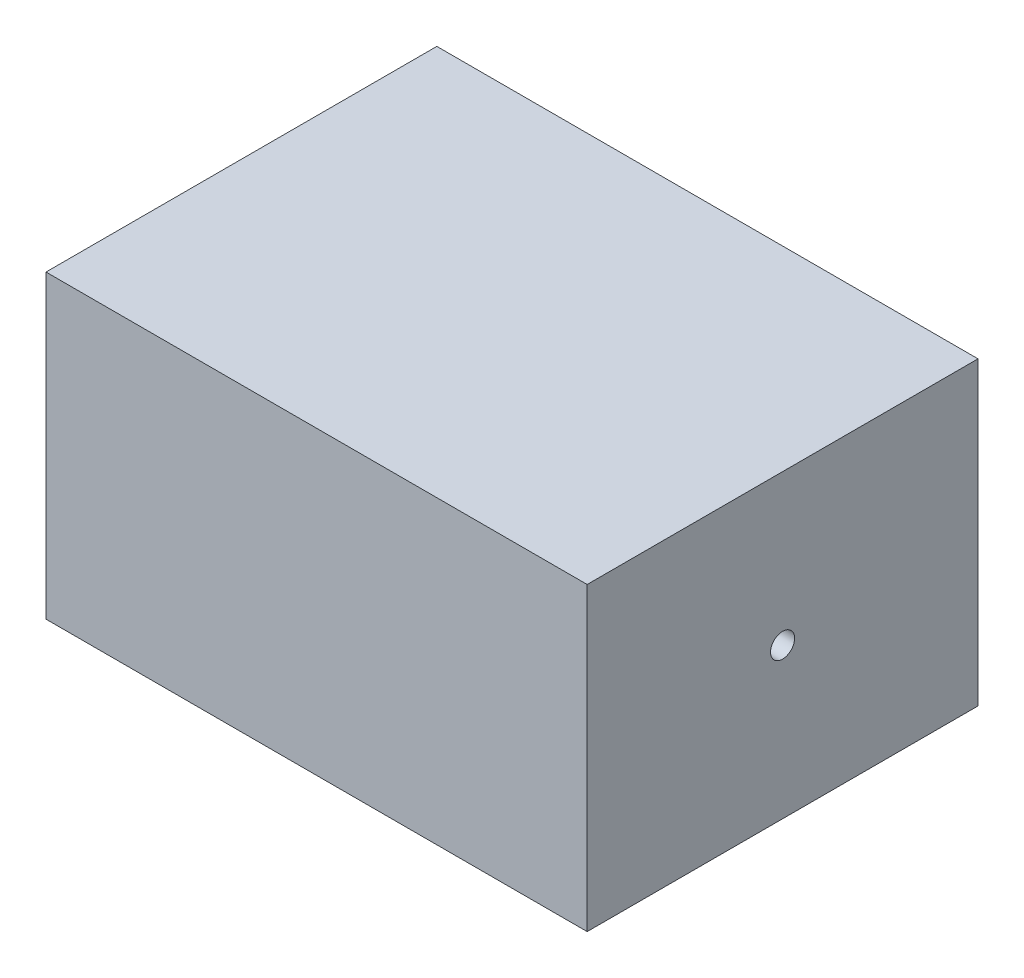
from build123d import *

# Parameters (mm, degrees)
SKETCH_1_W          = 90
SKETCH_1_H          = 50
EXTRUDE_1_DEPTH     = 65
SKETCH_2_R          = 2
CUT_EXTRUDE_1_DEPTH = 115.887883104


with BuildPart() as part:
    # 草图1 → 凸台-拉伸1 (new body)
    with BuildSketch(Plane.XY):
        with Locations((0.288461538, 4.567307692)):
            Rectangle(SKETCH_1_W, SKETCH_1_H)
    extrude(amount=EXTRUDE_1_DEPTH)

    # 草图2 → 切除-拉伸1 (cut, through all)
    with BuildSketch(Plane.ZY.offset(44.711538462)):
        with Locations((32.5, 4.567307692)):
            Circle(SKETCH_2_R)
    extrude(amount=-CUT_EXTRUDE_1_DEPTH, mode=Mode.SUBTRACT)


solid = part.part
